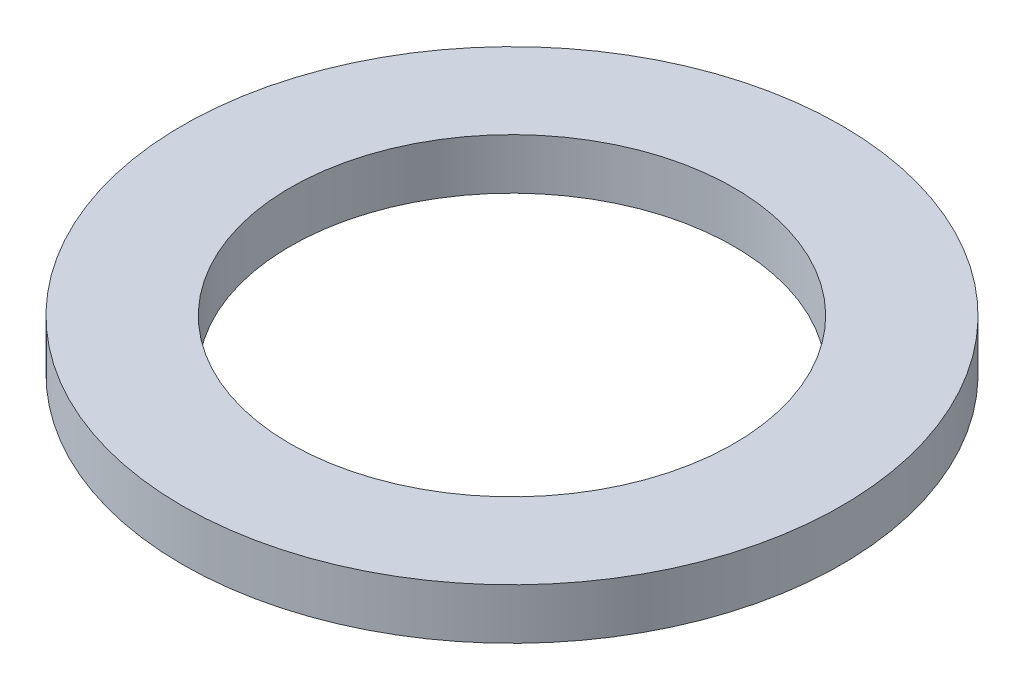
from build123d import *

# Parameters (mm, degrees)
SKETCH_1_R      = 26
SKETCH_1_R_2    = 17.5
EXTRUDE_1_DEPTH = 4


with BuildPart() as part:
    # 草图1 → 凸台-拉伸1 (new body)
    with BuildSketch(Plane(origin=(0, 0, 0), x_dir=(1, 0, 0), z_dir=(0, 1, 0))):
        with Locations(Location((0, 0, 0), (0, 0, 270))):
            Circle(SKETCH_1_R)
        with Locations(Location((0, 0, 0), (0, 0, 270))):
            Circle(SKETCH_1_R_2, mode=Mode.SUBTRACT)
    extrude(amount=EXTRUDE_1_DEPTH)


solid = part.part
